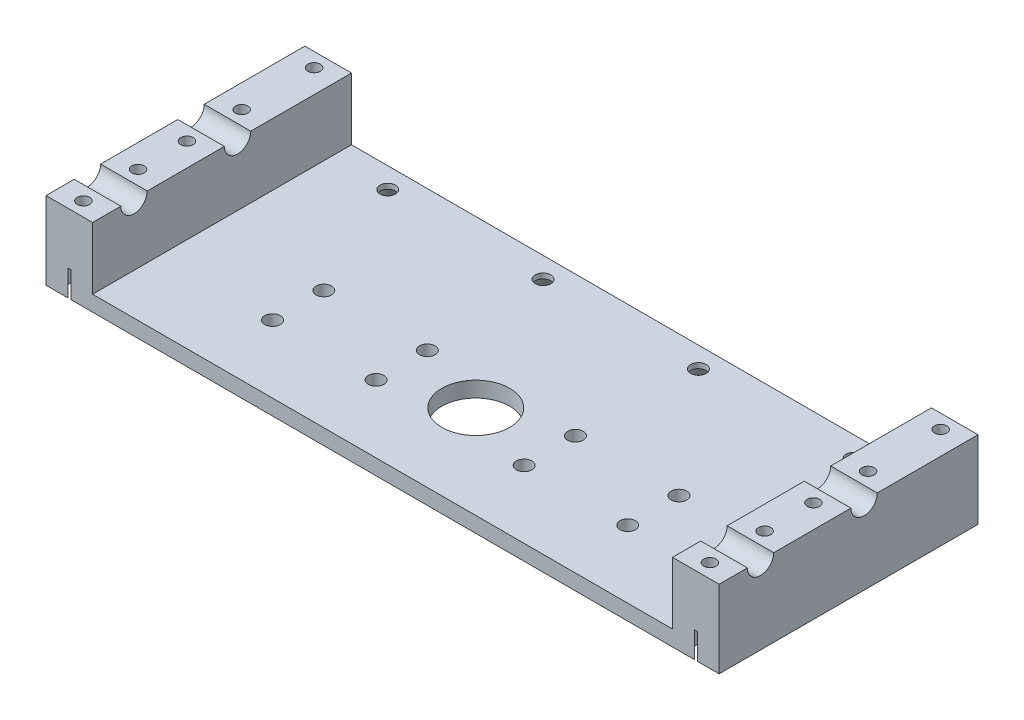
from build123d import *

# Parameters (mm, degrees)
EXTRUDE_1_DEPTH               = 65
SKETCH_4_W                    = 112
SKETCH_4_H                    = 50
CUT_EXTRUDE_1_DEPTH           = 20
SKETCH_5_W                    = 130
SKETCH_5_H                    = 50
SKETCH_5_R                    = 6.55
SKETCH_5_R_2                  = 1.5
EXTRUDE_2_DEPTH               = 3
SKETCH_6_R                    = 1.2
CUT_EXTRUDE_2_DEPTH           = 20
SKETCH_7_R                    = 1.5
CUT_EXTRUDE_3_DEPTH           = 20
SKETCH_8_R                    = 2.65
CUT_EXTRUDE_4_DEPTH           = 2
CUT_EXTRUDE_4_DRAFT           = -25
CUT_EXTRUDE_4_PROFILE_2_DEPTH = 2
CUT_EXTRUDE_4_PROFILE_2_DRAFT = -25
CUT_EXTRUDE_4_PROFILE_3_DEPTH = 2
CUT_EXTRUDE_4_PROFILE_3_DRAFT = -25
CUT_EXTRUDE_4_PROFILE_4_DEPTH = 2
CUT_EXTRUDE_4_PROFILE_4_DRAFT = -25
CUT_EXTRUDE_5_DEPTH           = 5


with BuildPart() as part:
    # 草图2 → 凸台-拉伸1 (new, symmetric)
    with BuildSketch(Plane(origin=(0, 0, 0), x_dir=(0, 0, -1), z_dir=(1, 0, 0))):
        with BuildLine():
            Line((-7.45, 12), (7.45, 12))
            ThreePointArc((7.45, 12), (10, 9.45), (12.55, 12))
            Line((12.55, 12), (32, 12))
            Line((32, 12), (32, 0))
            Line((32, 0), (-18, 0))
            Line((-18, 0), (-18, 12))
            Line((-18, 12), (-12.55, 12))
            ThreePointArc((-12.55, 12), (-10, 9.45), (-7.45, 12))
        make_face()
    extrude(amount=EXTRUDE_1_DEPTH, both=True)

    # 草图4 → 切除-拉伸1 (cut)
    with BuildSketch(Plane.XZ):
        with Locations((0, -7)):
            Rectangle(SKETCH_4_W, SKETCH_4_H)
    extrude(amount=-CUT_EXTRUDE_1_DEPTH, mode=Mode.SUBTRACT)


with BuildPart() as cut_extrude_1_piece_1:
    # of the separate pieces the step leaves, piece 1, a body of its own (cut_extrude_1_pieces)
    add(part.part.solids().sort_by_distance((-65, 12, 7.45))[0])



with BuildPart() as cut_extrude_1_piece_2:
    # of the separate pieces the step leaves, piece 2, a body of its own (cut_extrude_1_pieces)
    add(part.part.solids().sort_by_distance((56, 12, 7.45))[0])


with BuildPart() as cut_extrude_1_piece_1_1:
    add(cut_extrude_1_piece_1.part)

    add(cut_extrude_1_piece_2.part)  # 凸台-拉伸2 merges 切除-拉伸1 piece 2
    # 草图5 → 凸台-拉伸2 (add)
    with BuildSketch(Plane.XZ):
        with Locations((0, -7)):
            Rectangle(SKETCH_5_W, SKETCH_5_H)
        with Locations(Location((0, 0, 0), (0, 0, 270))):
            Circle(SKETCH_5_R, mode=Mode.SUBTRACT)
        with Locations(Location((-14.3, 4.95, 0), (0, 0, 270))):
            Circle(SKETCH_5_R_2, mode=Mode.SUBTRACT)
        with Locations(Location((34.3, -4.95, 0), (0, 0, 90))):
            Circle(SKETCH_5_R_2, mode=Mode.SUBTRACT)
        with Locations(Location((34.3, 4.95, 0), (0, 0, 270))):
            Circle(SKETCH_5_R_2, mode=Mode.SUBTRACT)
        with Locations(Location((-14.3, -4.95, 0), (0, 0, 90))):
            Circle(SKETCH_5_R_2, mode=Mode.SUBTRACT)
        with Locations(Location((-34.3, 4.95, 0), (0, 0, 90))):
            Circle(SKETCH_5_R_2, mode=Mode.SUBTRACT)
        with Locations(Location((-34.3, -4.95, 0), (0, 0, 270))):
            Circle(SKETCH_5_R_2, mode=Mode.SUBTRACT)
        with Locations(Location((14.3, -4.95, 0), (0, 0, 270))):
            Circle(SKETCH_5_R_2, mode=Mode.SUBTRACT)
        with Locations(Location((14.3, 4.95, 0), (0, 0, 90))):
            Circle(SKETCH_5_R_2, mode=Mode.SUBTRACT)
    extrude(amount=EXTRUDE_2_DEPTH)

    # 草图6 → 切除-拉伸2 (cut)
    with BuildSketch(Plane(origin=(0, 12, 0), x_dir=(1, 0, 0), z_dir=(0, 1, 0))):
        with Locations(Location((-60.5, -15.275, 0), (0, 0, 270))):
            Circle(SKETCH_6_R)
        with Locations(Location((-60.5, -4.725, 0), (0, 0, 90))):
            Circle(SKETCH_6_R)
        with Locations(Location((-60.5, 15.275, 0), (0, 0, 90))):
            Circle(SKETCH_6_R)
        with Locations(Location((-60.5, 4.725, 0), (0, 0, 270))):
            Circle(SKETCH_6_R)
        with Locations(Location((-60.5, 29.275, 0), (0, 0, 270))):
            Circle(SKETCH_6_R)
        with Locations(Location((60.5, 29.275, 0), (0, 0, 90))):
            Circle(SKETCH_6_R)
        with Locations(Location((60.5, 4.725, 0), (0, 0, 90))):
            Circle(SKETCH_6_R)
        with Locations(Location((60.5, 15.275, 0), (0, 0, 270))):
            Circle(SKETCH_6_R)
        with Locations(Location((60.5, -4.725, 0), (0, 0, 270))):
            Circle(SKETCH_6_R)
        with Locations(Location((60.5, -15.275, 0), (0, 0, 90))):
            Circle(SKETCH_6_R)
    extrude(amount=-CUT_EXTRUDE_2_DEPTH, mode=Mode.SUBTRACT)

    # 草图7 → 切除-拉伸3 (cut)
    with BuildSketch(Plane.XZ.offset(3)):
        with Locations(Location((-15, -28, 0), (0, 0, 270))):
            Circle(SKETCH_7_R)
        with Locations(Location((-45, -28, 0), (0, 0, 270))):
            Circle(SKETCH_7_R)
        with Locations(Location((45, -28, 0), (0, 0, 270))):
            Circle(SKETCH_7_R)
        with Locations(Location((15, -28, 0), (0, 0, 270))):
            Circle(SKETCH_7_R)
    extrude(amount=-CUT_EXTRUDE_3_DEPTH, mode=Mode.SUBTRACT)


with BuildPart() as cut_extrude_4_tool:
    # 草图8 → 切除-拉伸4 (with draft: the straight prism first)
    with BuildSketch(Plane.XZ.offset(3)):
        with Locations((-45, -28)):
            Circle(SKETCH_8_R)
    extrude(amount=-CUT_EXTRUDE_4_DEPTH)
    # 切除-拉伸4: the draft: its side faces are tilted about the plane it starts from
    cut_extrude_4_sides = [cut_extrude_4_tool.faces().sort_by_distance(p)[0] for p in [
        (-47.65, -2, -28),
    ]]
    draft(cut_extrude_4_sides, Plane.XZ.offset(3), CUT_EXTRUDE_4_DRAFT)


with BuildPart() as cut_extrude_1_piece_1_2:
    add(cut_extrude_1_piece_1_1.part)

    # 切除-拉伸4: cut by cut_extrude_4_tool
    add(cut_extrude_4_tool.part, mode=Mode.SUBTRACT)


with BuildPart() as cut_extrude_4_profile_2_tool:
    # 草图8 → 切除-拉伸4 profile 2 (with draft: the straight prism first)
    with BuildSketch(Plane.XZ.offset(3)):
        with Locations((-15, -28)):
            Circle(SKETCH_8_R)
    extrude(amount=-CUT_EXTRUDE_4_PROFILE_2_DEPTH)
    # 切除-拉伸4 profile 2: the draft: its side faces are tilted about the plane it starts from
    cut_extrude_4_profile_2_sides = [cut_extrude_4_profile_2_tool.faces().sort_by_distance(p)[0] for p in [
        (-17.65, -2, -28),
    ]]
    draft(cut_extrude_4_profile_2_sides, Plane.XZ.offset(3), CUT_EXTRUDE_4_PROFILE_2_DRAFT)


with BuildPart() as cut_extrude_1_piece_1_3:
    add(cut_extrude_1_piece_1_2.part)

    # 切除-拉伸4 profile 2: cut by cut_extrude_4_profile_2_tool
    add(cut_extrude_4_profile_2_tool.part, mode=Mode.SUBTRACT)


with BuildPart() as cut_extrude_4_profile_3_tool:
    # 草图8 → 切除-拉伸4 profile 3 (with draft: the straight prism first)
    with BuildSketch(Plane.XZ.offset(3)):
        with Locations((15, -28)):
            Circle(SKETCH_8_R)
    extrude(amount=-CUT_EXTRUDE_4_PROFILE_3_DEPTH)
    # 切除-拉伸4 profile 3: the draft: its side faces are tilted about the plane it starts from
    cut_extrude_4_profile_3_sides = [cut_extrude_4_profile_3_tool.faces().sort_by_distance(p)[0] for p in [
        (12.35, -2, -28),
    ]]
    draft(cut_extrude_4_profile_3_sides, Plane.XZ.offset(3), CUT_EXTRUDE_4_PROFILE_3_DRAFT)


with BuildPart() as cut_extrude_1_piece_1_4:
    add(cut_extrude_1_piece_1_3.part)

    # 切除-拉伸4 profile 3: cut by cut_extrude_4_profile_3_tool
    add(cut_extrude_4_profile_3_tool.part, mode=Mode.SUBTRACT)


with BuildPart() as cut_extrude_4_profile_4_tool:
    # 草图8 → 切除-拉伸4 profile 4 (with draft: the straight prism first)
    with BuildSketch(Plane.XZ.offset(3)):
        with Locations((45, -28)):
            Circle(SKETCH_8_R)
    extrude(amount=-CUT_EXTRUDE_4_PROFILE_4_DEPTH)
    # 切除-拉伸4 profile 4: the draft: its side faces are tilted about the plane it starts from
    cut_extrude_4_profile_4_sides = [cut_extrude_4_profile_4_tool.faces().sort_by_distance(p)[0] for p in [
        (42.35, -2, -28),
    ]]
    draft(cut_extrude_4_profile_4_sides, Plane.XZ.offset(3), CUT_EXTRUDE_4_PROFILE_4_DRAFT)


with BuildPart() as cut_extrude_1_piece_1_5:
    add(cut_extrude_1_piece_1_4.part)

    # 切除-拉伸4 profile 4: cut by cut_extrude_4_profile_4_tool
    add(cut_extrude_4_profile_4_tool.part, mode=Mode.SUBTRACT)

    # 草图9 → 切除-拉伸5 (cut)
    with BuildSketch(Plane.XZ.offset(3)):
        Polygon((-58, -3.281624327), (-60.5, -1.838248654), (-63, -3.281624327), (-63, -6.168375673), (-60.5, -7.611751346), (-58, -6.168375673), align=None)
        Polygon((-58, -13.831624327), (-60.5, -12.388248654), (-63, -13.831624327), (-63, -16.718375673), (-60.5, -18.161751346), (-58, -16.718375673), align=None)
        Polygon((-58, -27.831624327), (-60.5, -26.388248654), (-63, -27.831624327), (-63, -30.718375673), (-60.5, -32.161751346), (-58, -30.718375673), align=None)
        Polygon((-58, 6.168375673), (-60.5, 7.611751346), (-63, 6.168375673), (-63, 3.281624327), (-60.5, 1.838248654), (-58, 3.281624327), align=None)
        Polygon((-58, 13.831624327), (-58, 16.718375673), (-60.5, 18.161751346), (-63, 16.718375673), (-63, 13.831624327), (-60.5, 12.388248654), align=None)
        Polygon((60.5, 12.388248654), (58, 13.831624327), (58, 16.718375673), (60.5, 18.161751346), (63, 16.718375673), (63, 13.831624327), align=None)
        Polygon((58, 3.281624327), (58, 6.168375673), (60.5, 7.611751346), (63, 6.168375673), (63, 3.281624327), (60.5, 1.838248654), align=None)
        Polygon((58, -30.718375673), (58, -27.831624327), (60.5, -26.388248654), (63, -27.831624327), (63, -30.718375673), (60.5, -32.161751346), align=None)
        Polygon((58, -16.718375673), (58, -13.831624327), (60.5, -12.388248654), (63, -13.831624327), (63, -16.718375673), (60.5, -18.161751346), align=None)
        Polygon((58, -6.168375673), (58, -3.281624327), (60.5, -1.838248654), (63, -3.281624327), (63, -6.168375673), (60.5, -7.611751346), align=None)
    extrude(amount=-CUT_EXTRUDE_5_DEPTH, mode=Mode.SUBTRACT)


solid = cut_extrude_1_piece_1_5.part
